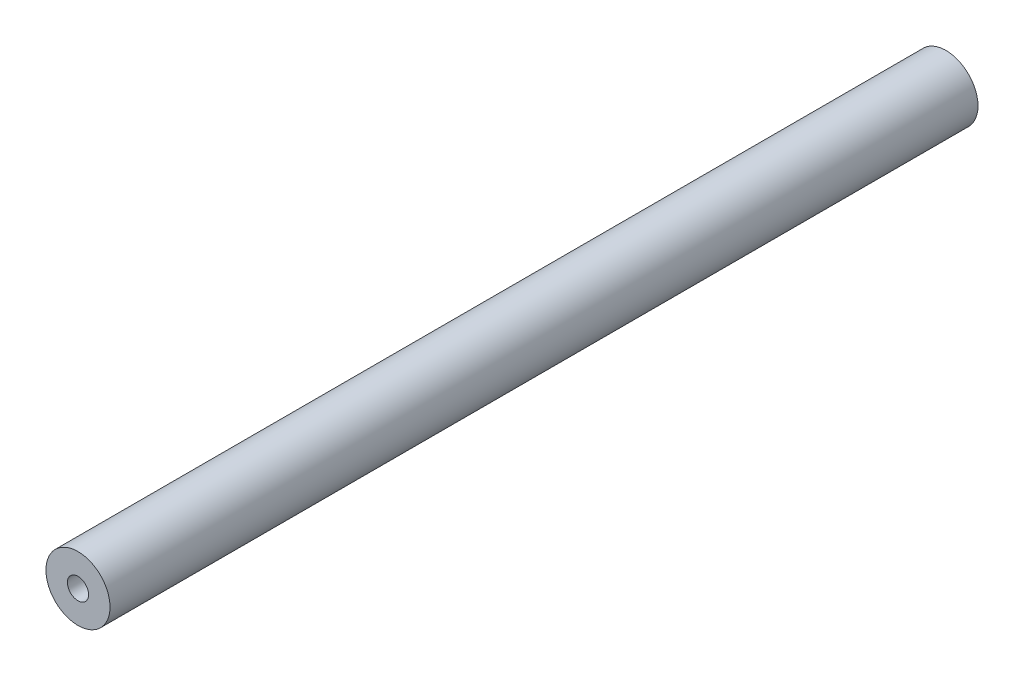
from build123d import *

# Parameters (mm, degrees)
SKETCH_1_R          = 5
EXTRUDE_1_DEPTH     = 135.5
SKETCH_2_R          = 1.65
CUT_EXTRUDE_1_DEPTH = 10
CUT_EXTRUDE_START   = -10
SKETCH_3_R          = 1.65
CUT_EXTRUDE_2_DEPTH = 10


with BuildPart() as part:
    # ｽｹｯﾁ1 → ﾎﾞｽ - 押し出し1 (new body)
    with BuildSketch(Plane.XY):
        Circle(SKETCH_1_R)
    extrude(amount=EXTRUDE_1_DEPTH)

    # ｽｹｯﾁ2 → ｶｯﾄ - 押し出し1 (cut)
    with BuildSketch(Plane.XY.offset(135.5)):
        Circle(SKETCH_2_R)
    extrude(amount=-CUT_EXTRUDE_1_DEPTH, mode=Mode.SUBTRACT)

    # ｽｹｯﾁ3 → ｶｯﾄ - 押し出し2 (cut)
    with BuildSketch(Plane(origin=(0, 0, 0), x_dir=(-1, 0, 0), z_dir=(0, 0, -1)).offset(CUT_EXTRUDE_START)):
        with Locations(Location((0, 0, 0), (0, 0, 180))):
            Circle(SKETCH_3_R)
    extrude(amount=CUT_EXTRUDE_2_DEPTH, mode=Mode.SUBTRACT)


solid = part.part
